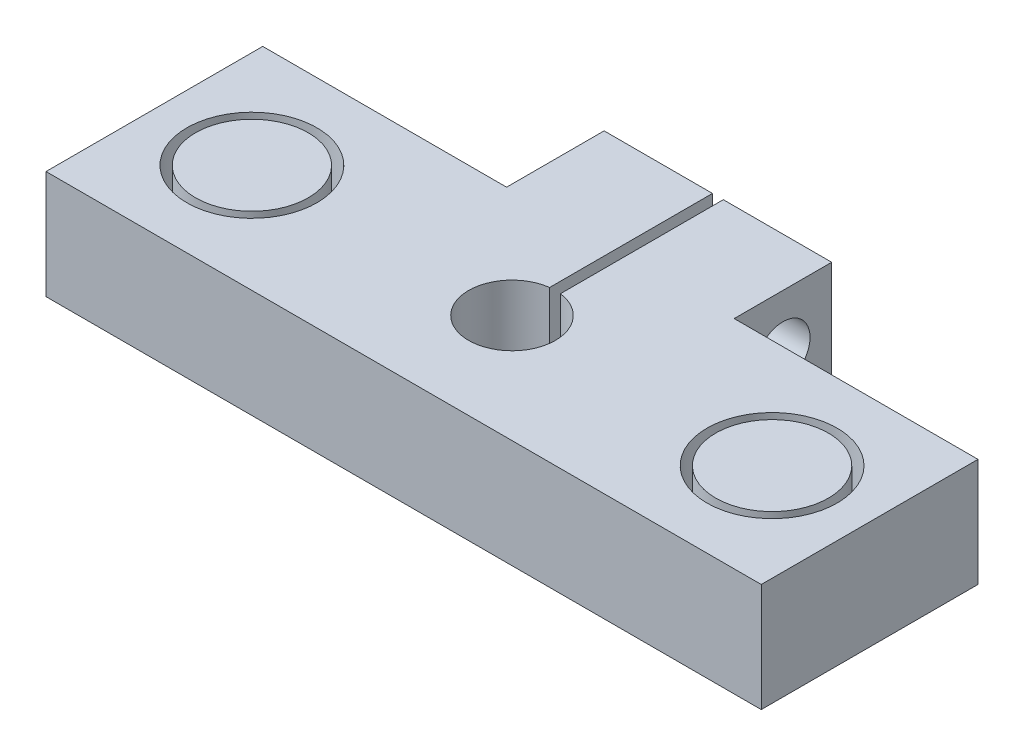
from build123d import *

# Parameters (mm, degrees)
BOSS_EXTRUDE1_DEPTH = 10
SKETCH2_R           = 2.5
CUT_EXTRUDE1_DEPTH  = 21
SKETCH3_R           = 6
CUT_EXTRUDE2_DEPTH  = 5
SKETCH4_R           = 5.2
BOSS_EXTRUDE2_DEPTH = 5


with BuildPart() as part:
    # Sketch1 → Boss-Extrude1 (new body)
    with BuildSketch(Plane(origin=(0, 0, 0), x_dir=(1, 0, 0), z_dir=(0, 1, 0))):
        with BuildLine():
            Line((10.5, 19), (5.5, 19))
            Line((5.5, 19), (0.5, 19))
            Line((0.5, 19), (0.5, 14))
            Line((0.5, 14), (0.5, 4))
            Line((0.5, 4), (0.5, 3.968626967))
            ThreePointArc((0.5, 3.968626967), (3, 2.645751311), (4, 0))
            ThreePointArc((4, 0), (-2.645751311, -3), (-0.5, 3.968626967))
            Line((-0.5, 3.968626967), (-0.5, 4))
            Line((-0.5, 4), (-0.5, 14))
            Line((-0.5, 14), (-0.5, 19))
            Line((-0.5, 19), (-5.5, 19))
            Line((-5.5, 19), (-10.5, 19))
            Line((-10.5, 19), (-10.5, 10))
            Line((-10.5, 10), (-33, 10))
            Line((-33, 10), (-33, -10))
            Line((-33, -10), (-24, -10))
            Line((-24, -10), (24, -10))
            Line((24, -10), (33, -10))
            Line((33, -10), (33, 10))
            Line((33, 10), (10.5, 10))
            Line((10.5, 10), (10.5, 19))
        make_face()
    extrude(amount=BOSS_EXTRUDE1_DEPTH)

    # Sketch2 → Cut-Extrude1 (cut)
    with BuildSketch(Plane(origin=(10.5, 0, 0), x_dir=(0, 0, -1), z_dir=(1, 0, 0))):
        with Locations((14.5, 5)):
            Circle(SKETCH2_R)
    extrude(amount=-CUT_EXTRUDE1_DEPTH, mode=Mode.SUBTRACT)

    # Sketch3 → Cut-Extrude2 (cut)
    with BuildSketch(Plane(origin=(0, 10, 0), x_dir=(1, 0, 0), z_dir=(0, 1, 0))):
        with Locations(Location((24, 0, 0), (0, 0, 270))):
            Circle(SKETCH3_R)
        with Locations(Location((-24, 0, 0), (0, 0, 270))):
            Circle(SKETCH3_R)
    extrude(amount=-CUT_EXTRUDE2_DEPTH, mode=Mode.SUBTRACT)

    # Sketch4 → Boss-Extrude2 (add)
    with BuildSketch(Plane(origin=(0, 5, 0), x_dir=(1, 0, 0), z_dir=(0, 1, 0))):
        with Locations(Location((24, 0, 0), (0, 0, 270))):
            Circle(SKETCH4_R)
        with Locations(Location((-24, 0, 0), (0, 0, 270))):
            Circle(SKETCH4_R)
    extrude(amount=BOSS_EXTRUDE2_DEPTH)


solid = part.part
